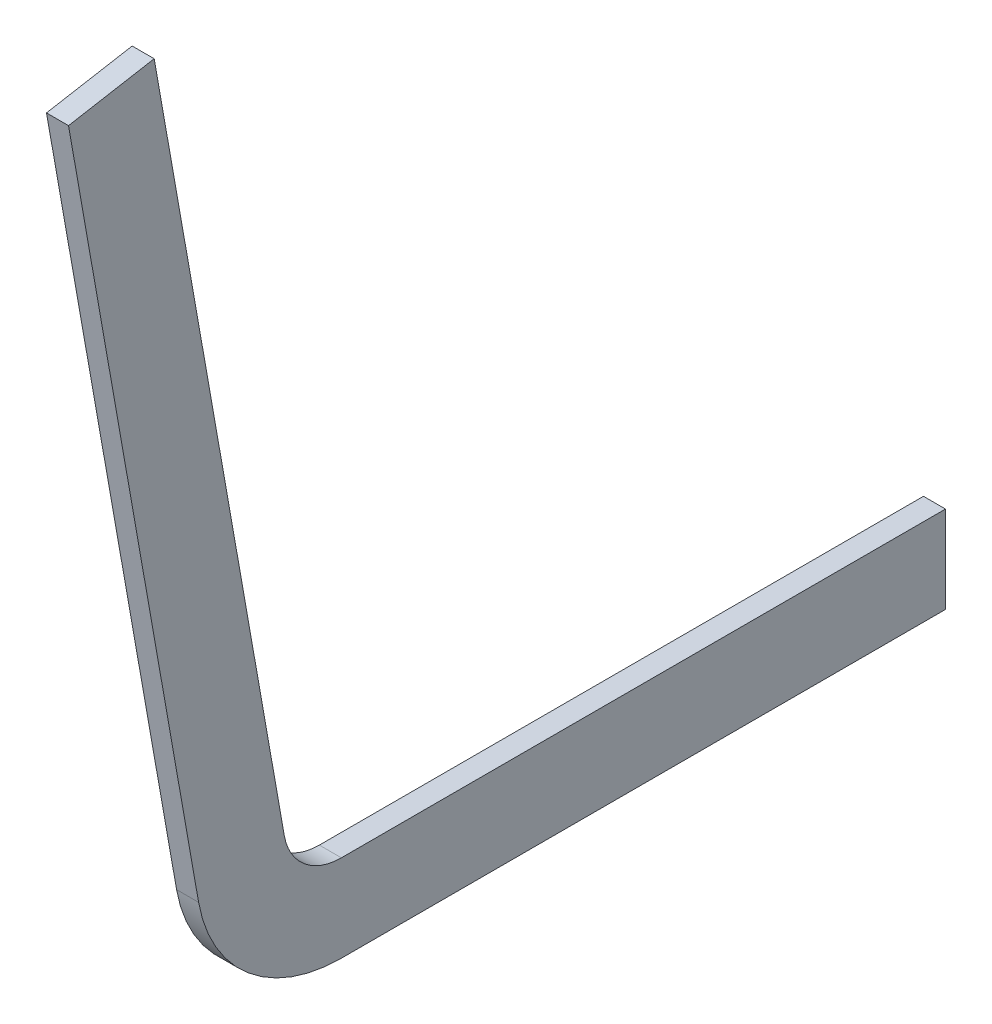
from build123d import *

# Parameters (mm, degrees)
BOSS_EXTRUDE1_DEPTH = 1.9


with BuildPart() as part:
    # Sketch1 → Boss-Extrude1 (new, symmetric)
    with BuildSketch(Plane(origin=(0, 0, 0), x_dir=(0, 0, -1), z_dir=(1, 0, 0))):
        with BuildLine():
            Line((-84.195498156, -182.4), (-80, -182.4))
            Line((-80, -182.4), (20, -182.4))
            Line((20, -182.4), (20, -167.4))
            Line((20, -167.4), (-80, -167.4))
            Line((-80, -167.4), (-84.195498156, -167.4))
            ThreePointArc((-84.195498156, -167.4), (-90.623374253, -165.060444431), (-94.043575686, -159.136481777))
            Line((-94.043575686, -159.136481777), (-116.478138504, -31.903753538))
            Line((-116.478138504, -31.903753538), (-131.250254799, -34.508476203))
            Line((-131.250254799, -34.508476203), (-108.815691981, -161.741204442))
            ThreePointArc((-108.815691981, -161.741204442), (-100.265188398, -176.551111078), (-84.195498156, -182.4))
        make_face()
    extrude(amount=BOSS_EXTRUDE1_DEPTH, both=True)


solid = part.part
